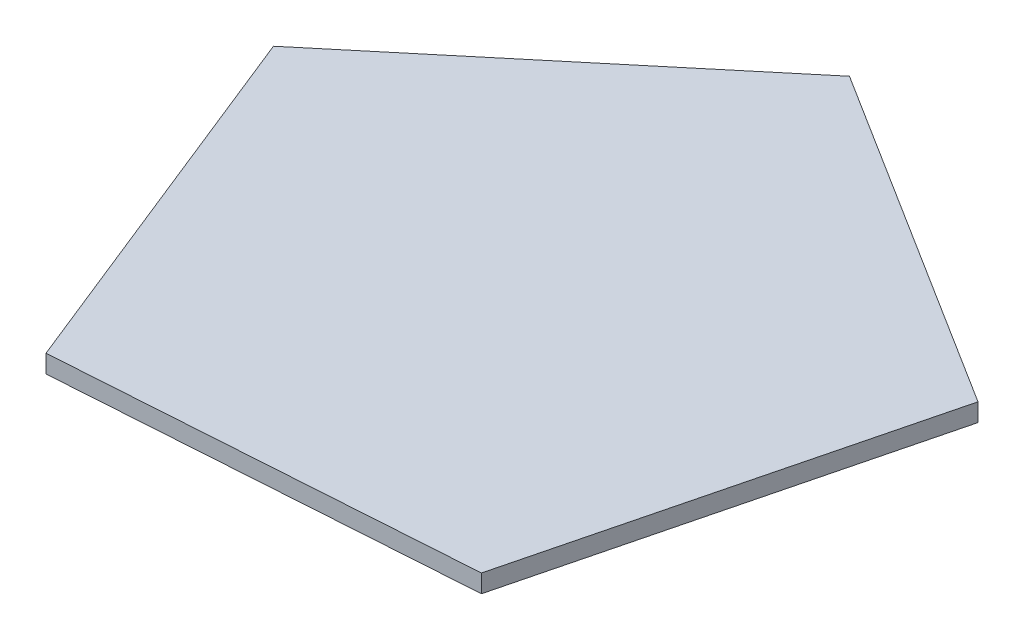
from build123d import *

# Parameters (mm, degrees)
BOSS_EXTRUDE1_DEPTH = 3.2


with BuildPart() as part:
    # Sketch1 → Boss-Extrude1 (new body)
    with BuildSketch(Plane(origin=(0, 0, 0), x_dir=(1, 0, 0), z_dir=(0, 1, 0))):
        Polygon((-59.925822748, 15.118064705), (-32.896231583, -52.321105303), (39.594833528, -47.454286112), (57.367184482, 22.992743574), (-4.139963679, 61.664583135), align=None)
    extrude(amount=BOSS_EXTRUDE1_DEPTH)


solid = part.part
